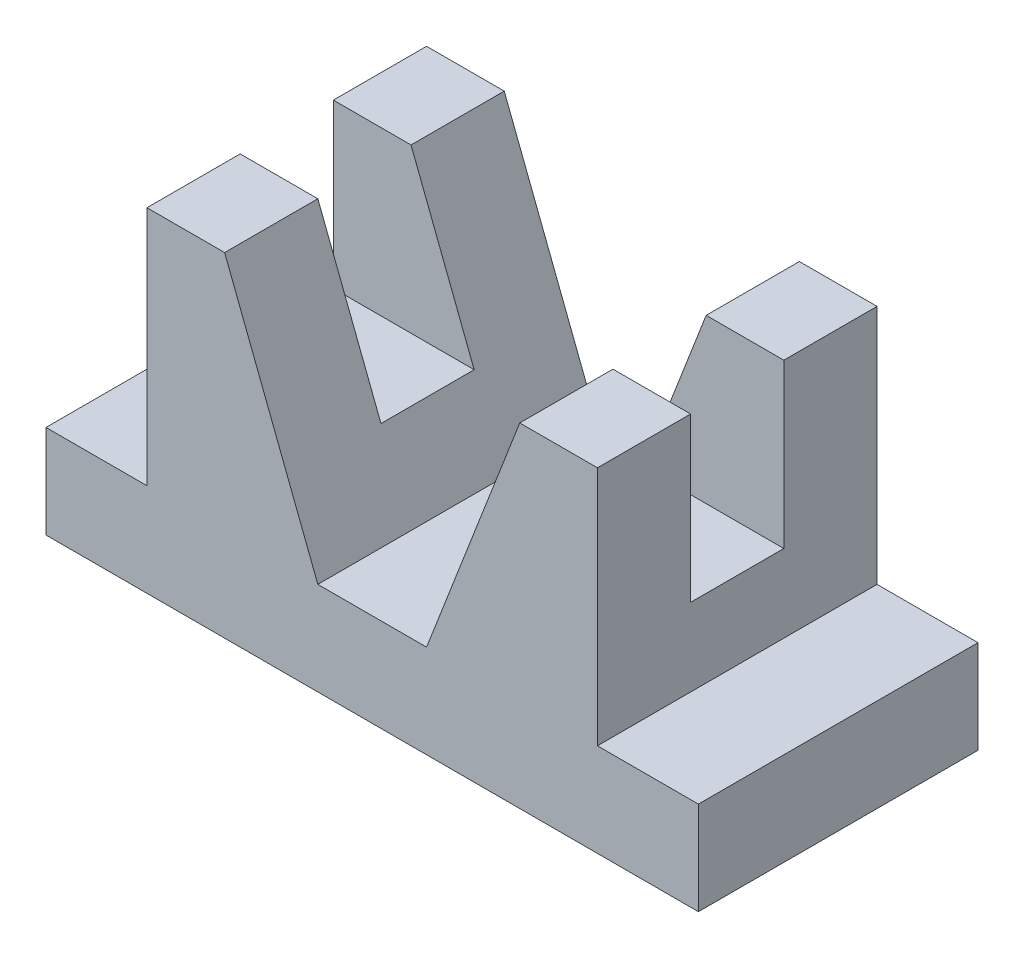
from build123d import *

# Parameters (mm, degrees)
SALIENTE_EXTRUIR1_DEPTH = 36
CROQUIS2_W              = 22
CROQUIS2_H              = 12
CORTAR_EXTRUIR2_DEPTH   = 21


with BuildPart() as part:
    # Croquis1 → Saliente-Extruir1 (new body)
    with BuildSketch(Plane.XY):
        Polygon((-29, 6), (-29, 37), (-19, 37), (-7, 6), (7, 6), (19, 37), (29, 37), (29, 6), (42, 6), (42, -6), (-42, -6), (-42, 6), align=None)
    extrude(amount=-SALIENTE_EXTRUIR1_DEPTH)

    # Croquis2 → Cortar-Extruir2 (cut)
    with BuildSketch(Plane(origin=(0, 37, 0), x_dir=(1, 0, 0), z_dir=(0, 1, 0))):
        with Locations((-18, 18)):
            Rectangle(CROQUIS2_W, CROQUIS2_H)
        with Locations((18, 18)):
            Rectangle(CROQUIS2_W, CROQUIS2_H)
    extrude(amount=-CORTAR_EXTRUIR2_DEPTH, mode=Mode.SUBTRACT)


solid = part.part
